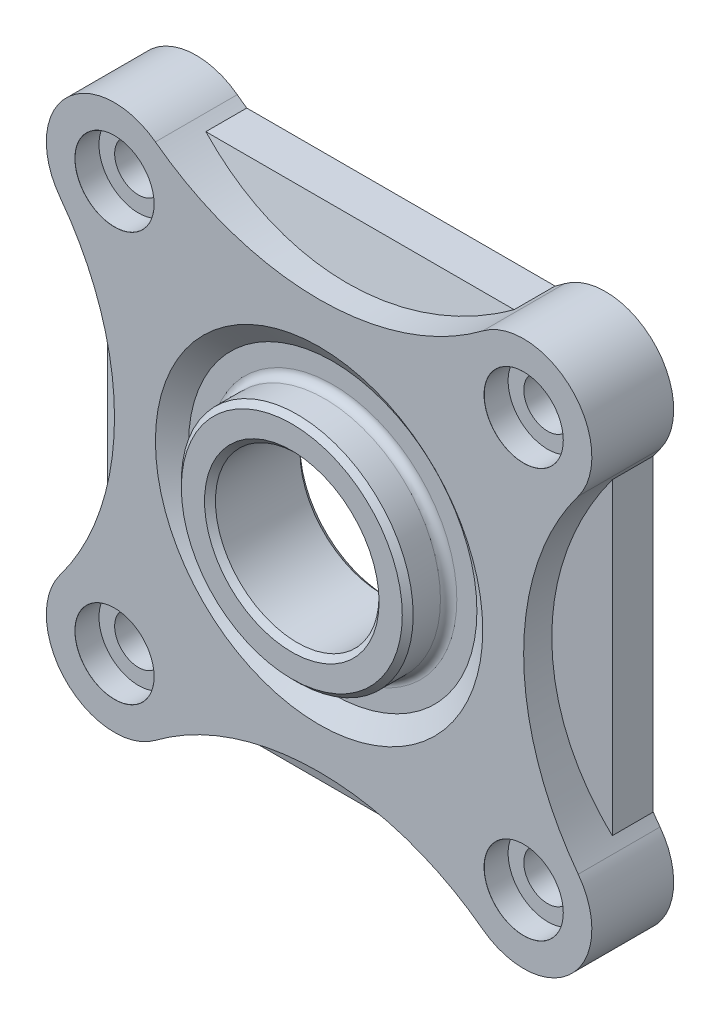
from build123d import *

# Parameters (mm, degrees)
SKETCH1_R                       = 25
BOSS_EXTRUDE1_DEPTH             = 30
SKETCH2_W                       = 185
SKETCH2_H                       = 185
BOSS_EXTRUDE2_DEPTH             = 15
DRAFT1_ANGLE                    = 15
DRAFT2_ANGLE                    = 15
DRAFT3_ANGLE                    = 15
DRAFT4_ANGLE                    = 15
SKETCH3_R                       = 42.5
BOSS_EXTRUDE3_DEPTH             = 40
CBORE_FOR_M16_SBHCS1_AT_2_COUNT = 2
CBORE_FOR_M16_SBHCS1_AT_2_PITCH = 150
CBORE_FOR_M16_SBHCS1_AT_3_COUNT = 2
CBORE_FOR_M16_SBHCS1_AT_3_PITCH = 150
CBORE_FOR_M16_SBHCS1_AT_4_COUNT = 2
CBORE_FOR_M16_SBHCS1_AT_4_PITCH = 212.132034356
SKETCH6_R                       = 30
CUT_EXTRUDE1_DEPTH              = 147.969384567
SKETCH7_R                       = 77.5
CUT_EXTRUDE2_DEPTH              = 5
FILLET1_R                       = 3
CHAMFER1_SIZE                   = 2


with BuildPart() as part:
    # Sketch1 → Boss-Extrude1 (new body)
    with BuildSketch(Plane.XY):
        with BuildLine():
            ThreePointArc((-60, 95), (-52.639320225, 86.180339887), (-50, 75))
            ThreePointArc((-50, 75), (-67.09430585, 51.282917549), (-95, 60))
            ThreePointArc((-95, 60), (-75, 0), (-95, -60))
            ThreePointArc((-95, -60), (-67.09430585, -51.282917549), (-50, -75))
            ThreePointArc((-50, -75), (-52.639320225, -86.180339887), (-60, -95))
            ThreePointArc((-60, -95), (0, -75), (60, -95))
            ThreePointArc((60, -95), (57.32233047, -57.32233047), (95, -60))
            ThreePointArc((95, -60), (75, 0), (95, 60))
            ThreePointArc((95, 60), (57.32233047, 57.32233047), (60, 95))
            ThreePointArc((60, 95), (0, 75), (-60, 95))
        make_face()
        with Locations((-75, 75)):
            Circle(SKETCH1_R)
        with Locations((75, 75)):
            Circle(SKETCH1_R)
        with Locations((75, -75)):
            Circle(SKETCH1_R)
        with Locations((-75, -75)):
            Circle(SKETCH1_R)
    extrude(amount=BOSS_EXTRUDE1_DEPTH)

    # Sketch2 → Boss-Extrude2 (add)
    with BuildSketch(Plane.XY):
        Rectangle(SKETCH2_W, SKETCH2_H)
    extrude(amount=BOSS_EXTRUDE2_DEPTH)

    # Draft1
    draft1_faces = [part.faces().sort_by_distance(p)[0] for p in [
        (85.444692503, 0, 15),
    ]]
    draft(draft1_faces, Plane(origin=(92.5, -92.5, 15), x_dir=(0, 0, 1), z_dir=(1, 0, 0)), DRAFT1_ANGLE)

    # Draft2
    draft2_faces = [part.faces().sort_by_distance(p)[0] for p in [
        (0, 85.444692503, 15),
    ]]
    draft(draft2_faces, Plane(origin=(-92.5, 92.5, 15), x_dir=(0, 0, 1), z_dir=(0, 1, 0)), DRAFT2_ANGLE)

    # Draft3
    draft3_faces = [part.faces().sort_by_distance(p)[0] for p in [
        (-85.444692503, 0, 15),
    ]]
    draft(draft3_faces, Plane(origin=(-92.5, -92.5, 15), x_dir=(0, 0, -1), z_dir=(-1, 0, 0)), DRAFT3_ANGLE)

    # Draft4
    draft4_faces = [part.faces().sort_by_distance(p)[0] for p in [
        (0, -85.444692503, 15),
    ]]
    draft(draft4_faces, Plane(origin=(-92.5, -92.5, 15), x_dir=(0, 0, -1), z_dir=(0, -1, 0)), DRAFT4_ANGLE)

    # Sketch3 → Boss-Extrude3 (add)
    with BuildSketch(Plane.XY):
        Circle(SKETCH3_R)
    extrude(amount=BOSS_EXTRUDE3_DEPTH)

    # Sketch5 → CBORE for M16 SBHCS1 (revolve, cut)
    with BuildSketch(Plane(origin=(-75, 75, 30), x_dir=(0, -1, 0), z_dir=(1, 0, 0))):
        Polygon((0, 0), (0, 30), (8.75, 30), (8.75, 8.8), (14.5, 8.8), (14.5, 0.025), (14.525, 0), align=None)
    cbore_for_m16_sbhcs1 = revolve(axis=Axis((-75, 75, 36.35), (0, 0, -1)), mode=Mode.SUBTRACT)

    # CBORE for M16 SBHCS1 at 2: CBORE for M16 SBHCS1 ×2
    with Locations(*[(i * CBORE_FOR_M16_SBHCS1_AT_2_PITCH, 0, 0) for i in range(1, CBORE_FOR_M16_SBHCS1_AT_2_COUNT)]):
        add(cbore_for_m16_sbhcs1, mode=Mode.SUBTRACT)

    # CBORE for M16 SBHCS1 at 3: CBORE for M16 SBHCS1 ×2
    with Locations(*[(0, -i * CBORE_FOR_M16_SBHCS1_AT_3_PITCH, 0) for i in range(1, CBORE_FOR_M16_SBHCS1_AT_3_COUNT)]):
        add(cbore_for_m16_sbhcs1, mode=Mode.SUBTRACT)

    # CBORE for M16 SBHCS1 at 4: CBORE for M16 SBHCS1 ×2
    with Locations(*[Vector(0.7071067811865476, -0.7071067811865476, 0) * (i * CBORE_FOR_M16_SBHCS1_AT_4_PITCH) for i in range(1, CBORE_FOR_M16_SBHCS1_AT_4_COUNT)]):
        add(cbore_for_m16_sbhcs1, mode=Mode.SUBTRACT)

    # Sketch6 → Cut-Extrude1 (cut, through all)
    with BuildSketch(Plane.XY.offset(40)):
        Circle(SKETCH6_R)
    extrude(amount=-CUT_EXTRUDE1_DEPTH, mode=Mode.SUBTRACT)

    # Sketch7 → Cut-Extrude2 (cut)
    with BuildSketch(Plane(origin=(0, 0, 0), x_dir=(-1, 0, 0), z_dir=(0, 0, -1))):
        Circle(SKETCH7_R)
    extrude(amount=-CUT_EXTRUDE2_DEPTH, mode=Mode.SUBTRACT)

    # Sketch8 → Cut-Revolve1 (revolve, cut)
    with BuildSketch(Plane(origin=(0, 0, 0), x_dir=(0, 0, -1), z_dir=(1, 0, 0)), mode=Mode.PRIVATE) as cut_revolve1_sk:
        Polygon((-30, 42.5), (-30, 60), (-25, 52.859259966), (-25, 42.5), align=None)
    revolve(cut_revolve1_sk.sketch.rotate(Axis((0, 0, 77.404119515), (0, 0, -1)), 90), axis=Axis((0, 0, 77.404119515), (0, 0, -1)), mode=Mode.SUBTRACT)

    # Fillet1
    fillet1_edges = [part.edges().sort_by_distance(p)[0] for p in [
        (-42.5, 0, 25),
    ]]
    fillet(fillet1_edges, radius=FILLET1_R)

    # Chamfer1
    chamfer1_edges = [part.edges().sort_by_distance(p)[0] for p in [
        (-30, 0, 40),
        (-30, 0, 5),
        (-42.5, 0, 40),
    ]]
    chamfer(chamfer1_edges, length=CHAMFER1_SIZE)


solid = part.part
